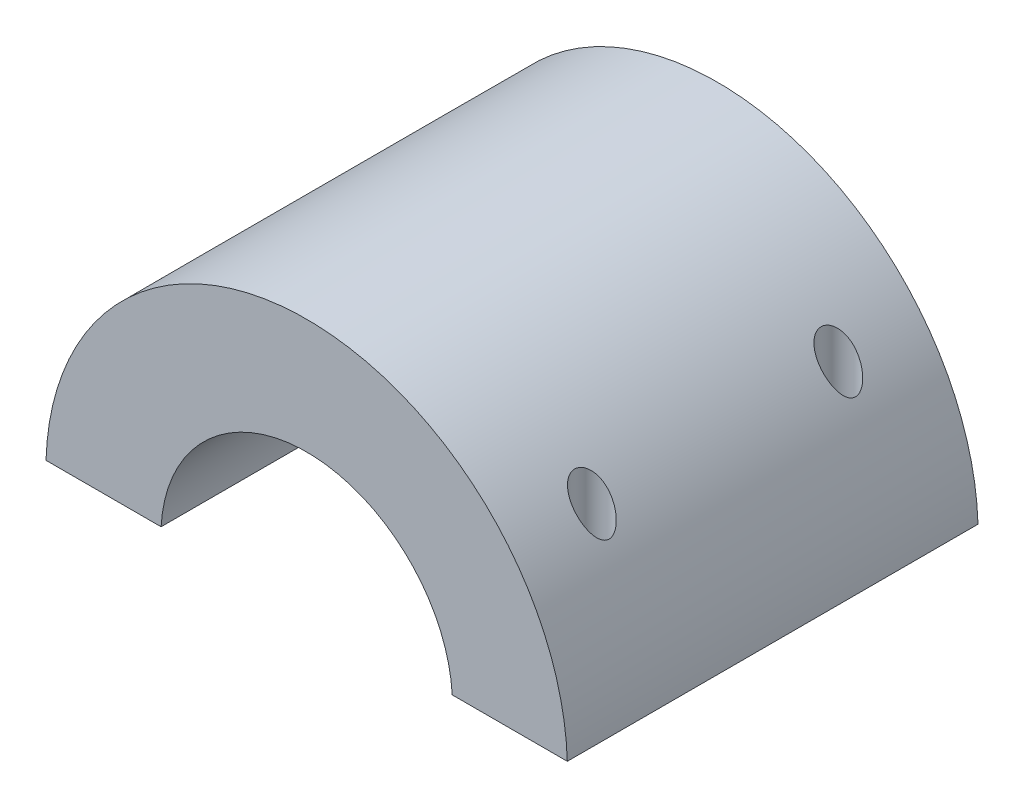
from build123d import *

# Parameters (mm, degrees)
BOSS_EXTRUDE1_DEPTH         = 50
TAP_DRILL_FOR_M5X0_8_TAP1_D = 4.2


with BuildPart() as part:
    # Sketch1 → Boss-Extrude1 (new body)
    with BuildSketch(Plane.XY):
        with BuildLine():
            Line((-31.734248061, 1), (-17.721808598, 1))
            ThreePointArc((-17.721808598, 1), (0, 17.75), (17.721808598, 1))
            Line((17.721808598, 1), (31.734248061, 1))
            ThreePointArc((31.734248061, 1), (0, 31.75), (-31.734248061, 1))
        make_face()
    extrude(amount=BOSS_EXTRUDE1_DEPTH)

    # Tap Drill for M5x0.8 Tap1 (through all)
    with Locations(Plane(origin=(-24.72802833, 1, 40), x_dir=(0, 0, -1), z_dir=(0, -1, 0))):
        with Locations((0, 0), (30, 0), (0, 49.45605666), (30, 49.45605666)):
            Hole(TAP_DRILL_FOR_M5X0_8_TAP1_D / 2)


solid = part.part
